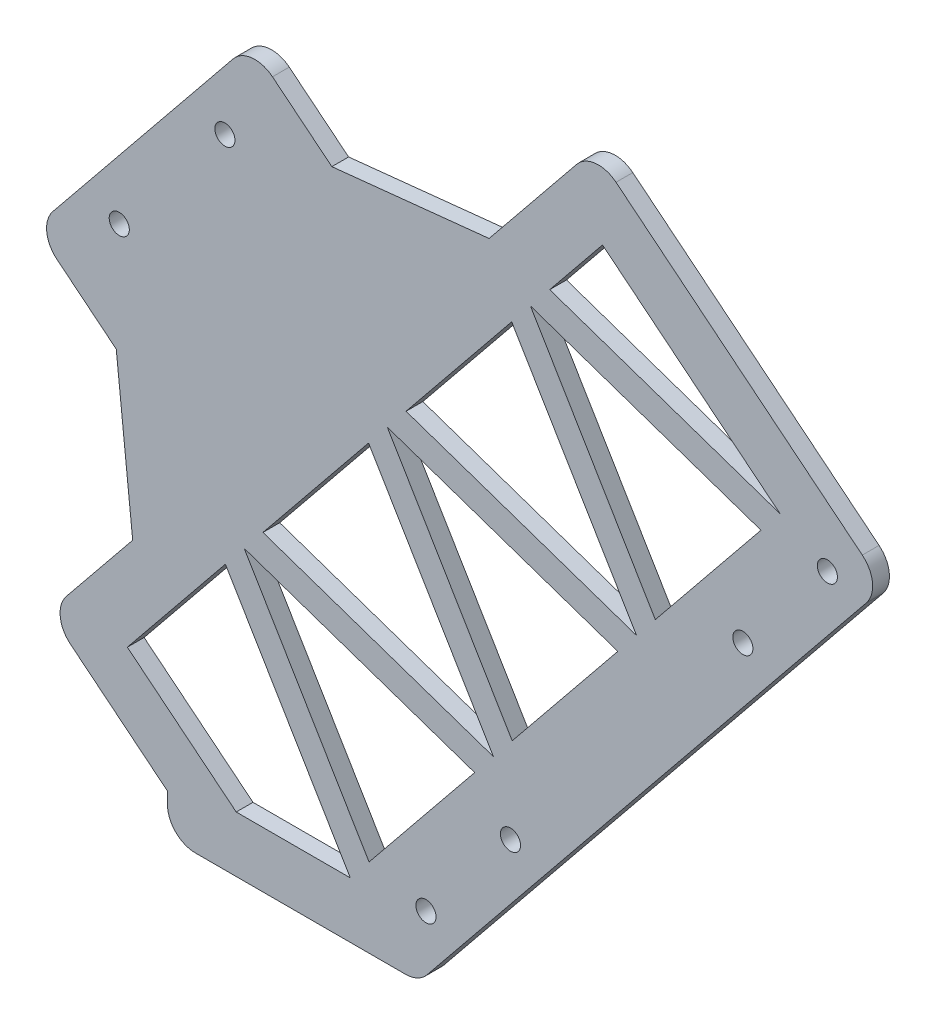
from build123d import *

# Parameters (mm, degrees)
BOSS_EXTRUDE1_START  = -0.50441
BOSS_EXTRUDE1_DEPTH  = 3
M3_CLEARANCE_HOLE1_D = 3.6
CHAMFER1_SIZE        = 20
CUT_EXTRUDE1_DEPTH   = 9
FILLET1_R            = 5
M3_CLEARANCE_HOLE2_D = 3.6


with BuildPart() as part:
    # Sketch3 → Boss-Extrude1 (new body)
    with BuildSketch(Plane(origin=(0, 0, -35.504410209), x_dir=(-1, 0, 0), z_dir=(0, 0, -1)).offset(BOSS_EXTRUDE1_START)):
        Polygon((-218.449999836, 74.7), (-263.37903282, 74.7), (-346.621494542, 177.349268983), (-294.797705634, 219.375284435), (-263.37903282, 180.63179067), (-233.345595882, 204.98712461), (-194.783185306, 157.434431261), (-224.816622244, 133.079097321), (-197.200065818, 99.024129816), (-218.449999836, 81.791695172), align=None)
    extrude(amount=BOSS_EXTRUDE1_DEPTH)

    # M3 Clearance Hole1 (through all)
    with Locations(Plane(origin=(0, 0, -38), x_dir=(-1, 0, 0), z_dir=(0, 0, -1))):
        with Locations((-264.683828169, 86.311168448), (-279.800535078, 104.952122614), (-321.371479078, 156.214746571), (-336.488185987, 174.855700737)):
            Hole(M3_CLEARANCE_HOLE1_D / 2)

    # Chamfer1
    chamfer1_edges = [part.edges().sort_by_distance(p)[0] for p in [
        (224.816622244, 133.079097321, -36.500000209),
        (263.37903282, 180.63179067, -36.500000209),
    ]]
    chamfer(chamfer1_edges, length=CHAMFER1_SIZE)

    # Sketch11 → Cut-Extrude1 (cut)
    with BuildSketch(Plane(origin=(0, 0, -38), x_dir=(-1, 0, 0), z_dir=(0, 0, -1))):
        Polygon((-211.265757933, 100.492566173), (-228.809311315, 122.126151879), (-251.146132676, 84.7), (-230.74013843, 84.7), align=None)
        Polygon((-254.500346294, 88.836201271), (-232.163524933, 126.26235315), (-273.396229931, 112.137393978), align=None)
        Polygon((-235.517738552, 130.39855442), (-254.413622188, 153.699747128), (-276.750443549, 116.273595249), align=None)
        Polygon((-280.104657167, 120.40979652), (-257.767835806, 157.835948399), (-299.000540804, 143.710989227), align=None)
        Polygon((-261.122049425, 161.972149669), (-280.017933061, 185.273342377), (-302.354754422, 147.847190498), align=None)
        Polygon((-305.708968041, 151.983391768), (-283.372146679, 189.409543648), (-324.604851677, 175.284584476), align=None)
        Polygon((-286.818200173, 193.658995967), (-296.266141991, 205.309592321), (-328.050905171, 179.534036795), align=None)
    extrude(amount=-CUT_EXTRUDE1_DEPTH, mode=Mode.SUBTRACT)

    # Fillet1
    fillet1_edges = [part.edges().sort_by_distance(p)[0] for p in [
        (218.449999836, 74.7, -36.500000209),
        (197.200065818, 99.024129816, -36.500000209),
        (194.783185306, 157.434431261, -36.500000209),
        (233.345595882, 204.98712461, -36.500000209),
        (294.797705634, 219.375284435, -36.500000209),
        (346.621494542, 177.349268983, -36.500000209),
        (263.37903282, 74.7, -36.500000209),
    ]]
    fillet(fillet1_edges, radius=FILLET1_R)

    # M3 Clearance Hole2 (through all)
    with Locations(Plane(origin=(0, 0, -38), x_dir=(-1, 0, 0), z_dir=(0, 0, -1))):
        with Locations((-209.81921101, 165.341079734), (-228.715065901, 188.642236994)):
            Hole(M3_CLEARANCE_HOLE2_D / 2)


solid = part.part
